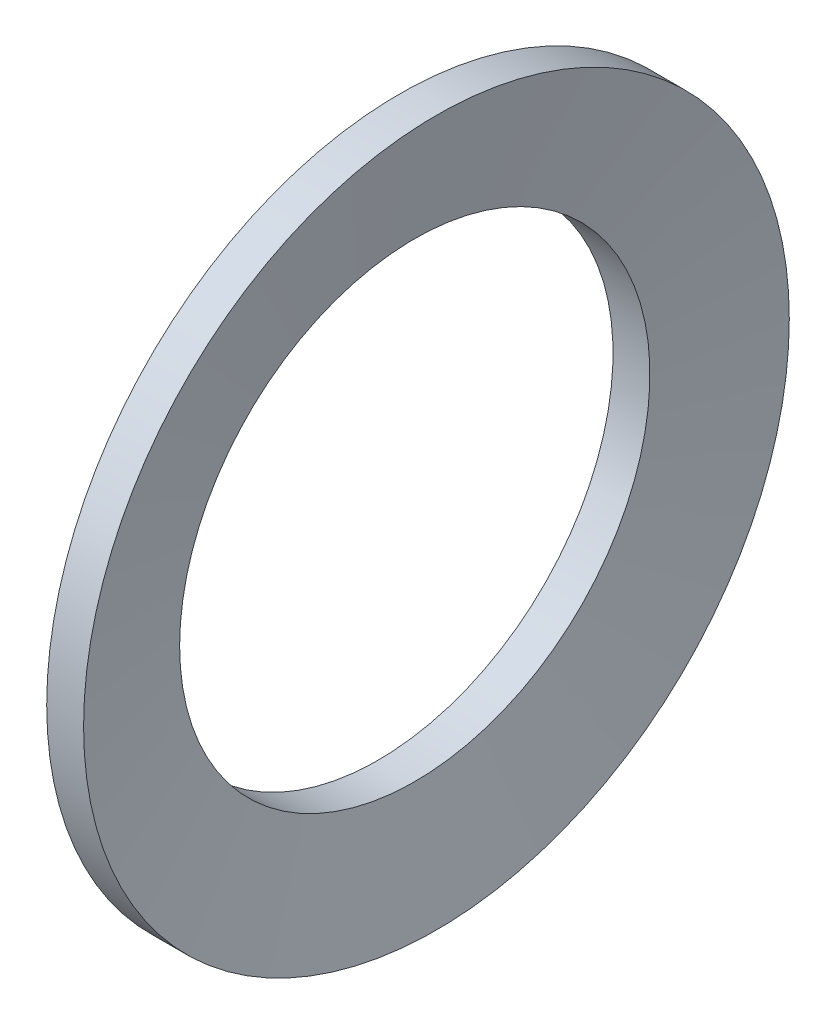
from build123d import *


with BuildPart() as part:
    # Sketch1 → Revolve1 (revolve)
    with BuildSketch(Plane.XY, mode=Mode.PRIVATE) as revolve1_sk:
        Polygon((-2.4892, 9.9949), (-1.567706327, 14.9987), (0, 14.9987), (-0.921493673, 9.9949), align=None)
    revolve(revolve1_sk.sketch.rotate(Axis((0, 0, 0), (1, 0, 0)), 90), axis=Axis((0, 0, 0), (1, 0, 0)))


solid = part.part
